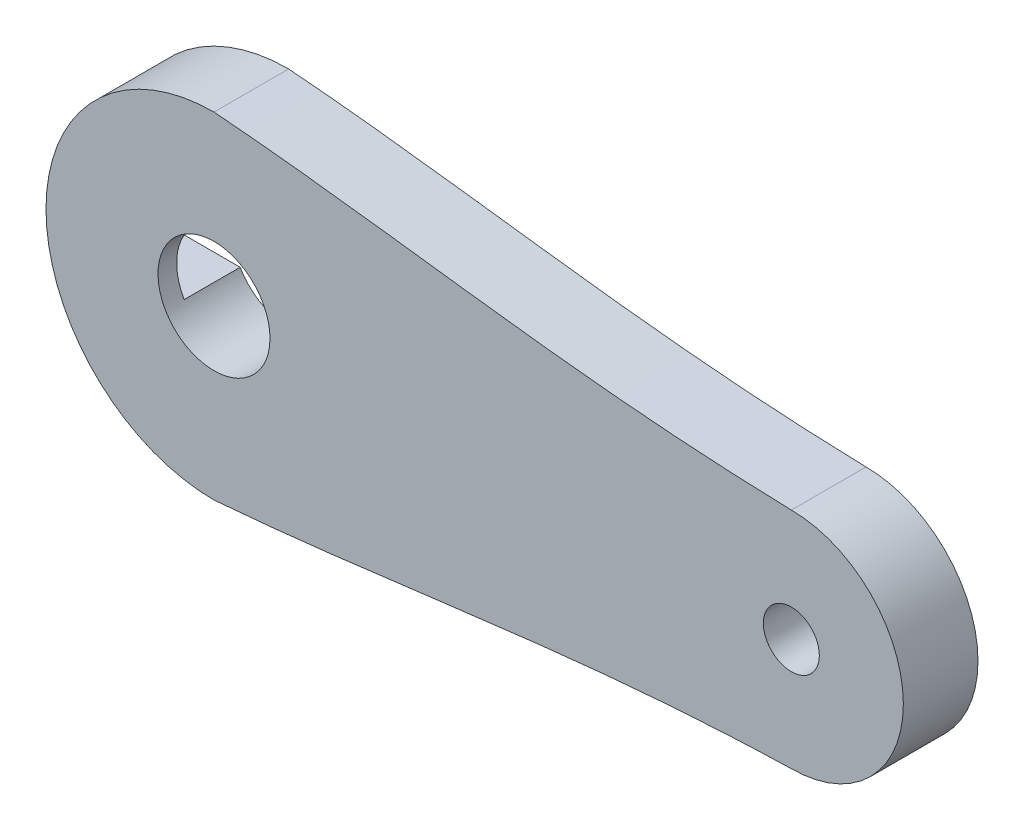
from build123d import *

# Parameters (mm, degrees)
SKETCH_1_R          = 3
SKETCH_1_R_2        = 1.5
EXTRUDE_1_DEPTH     = 4
CUT_EXTRUDE_1_DEPTH = 3


with BuildPart() as part:
    # 草图1 → 凸台-拉伸1 (new body)
    with BuildSketch(Plane.XY):
        with BuildLine():
            ThreePointArc((0, 9), (-9, 0), (0, -9))
            add(Edge.make_bspline(
                [(0, -9), (10.112579717, -8.18843742), (18.689885647, -6.328249505), (30.93, -6)],
                knots=[0, 0, 0, 0, 1, 1, 1, 1], degree=3))
            ThreePointArc((30.93, -6), (36.93, 0), (30.93, 6))
            add(Edge.make_bspline(
                [(0, 9), (10.112579717, 8.18843742), (18.689885647, 6.328249505), (30.93, 6)],
                knots=[0, 0, 0, 0, 1, 1, 1, 1], degree=3))
        make_face()
        Circle(SKETCH_1_R, mode=Mode.SUBTRACT)
        with Locations((30.93, 0)):
            Circle(SKETCH_1_R_2, mode=Mode.SUBTRACT)
    extrude(amount=EXTRUDE_1_DEPTH)

    # 草图2 → 切除-拉伸1 (cut)
    with BuildSketch(Plane.XY):
        Polygon((-2.598076211, 1.5), (-7, 1.5), (-7, -1.5), (9, -1.5), (9, 1.5), align=None)
    extrude(amount=CUT_EXTRUDE_1_DEPTH, mode=Mode.SUBTRACT)


solid = part.part
